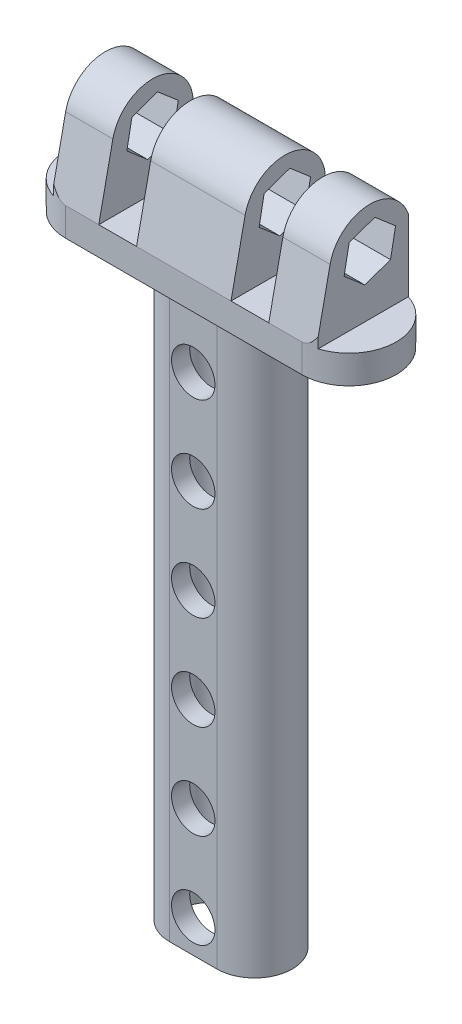
from build123d import *

# Parameters (mm, degrees)
EXTRUDE_1_DEPTH     = 3
EXTRUDE_2_DEPTH     = 14
EXTRUDE_3_DEPTH     = 60
SKETCH_4_R          = 2.3
CUT_EXTRUDE_1_DEPTH = 60
SKETCH_6_W          = 4
SKETCH_6_H          = 10.529479437
CUT_EXTRUDE_2_DEPTH = 60
CUT_EXTRUDE_4_DEPTH = 60


with BuildPart() as part:
    # 草图1 → 凸台-拉伸1 (new body)
    with BuildSketch(Plane(origin=(0, 0, 0), x_dir=(1, 0, 0), z_dir=(0, 1, 0))):
        with BuildLine():
            Line((-12.5, 5), (12.5, 5))
            ThreePointArc((12.5, 5), (17.5, 0), (12.5, -5))
            Line((12.5, -5), (-12.5, -5))
            ThreePointArc((-12.5, -5), (-17.5, 0), (-12.5, 5))
        make_face()
    extrude(amount=EXTRUDE_1_DEPTH)

    # 草图2 → 凸台-拉伸2 (add, symmetric)
    with BuildSketch(Plane(origin=(0, 0, 0), x_dir=(0, 0, -1), z_dir=(1, 0, 0))):
        with BuildLine():
            Line((-5, 3), (-3.508412685, 10.112107418))
            ThreePointArc((-3.508412685, 10.112107418), (1.143689593, 13.506528918), (5, 9.229494551))
            Line((5, 9.229494551), (5, 3))
            Line((5, 3), (-5, 3))
        make_face()
        Polygon((2.88904253, 7.347609244), (3.424289305, 10.184305249), (1.235261889, 12.066190555), (-1.489012301, 11.111379858), (-2.024259076, 8.274683853), (0.164768339, 6.392798546), align=None, mode=Mode.SUBTRACT)
    extrude(amount=EXTRUDE_2_DEPTH, both=True)

    # 草图3 → 凸台-拉伸3 (add)
    with BuildSketch(Plane.XZ):
        with BuildLine():
            Line((-2.5, 4), (2.5, 4))
            ThreePointArc((2.5, 4), (6.5, 0), (2.5, -4))
            Line((2.5, -4), (-2.5, -4))
            ThreePointArc((-2.5, -4), (-6.5, 0), (-2.5, 4))
        make_face()
        with BuildLine():
            Line((-2.705614888, 2.07197125), (2.705614888, 2.07197125))
            ThreePointArc((2.705614888, 2.07197125), (4.777586138, 0), (2.705614888, -2.07197125))
            Line((2.705614888, -2.07197125), (-2.705614888, -2.07197125))
            ThreePointArc((-2.705614888, -2.07197125), (-4.777586138, 0), (-2.705614888, 2.07197125))
        make_face(mode=Mode.SUBTRACT)
    extrude(amount=EXTRUDE_3_DEPTH)

    # 草图4 → 切除-拉伸1 (cut)
    with BuildSketch(Plane.XY.offset(4)):
        with Locations((0, -6.528023855)):
            Circle(SKETCH_4_R)
        with Locations((0, -16.528023855)):
            Circle(SKETCH_4_R)
        with Locations((0, -26.528023855)):
            Circle(SKETCH_4_R)
        with Locations((0, -36.528023855)):
            Circle(SKETCH_4_R)
        with Locations((0, -46.528023855)):
            Circle(SKETCH_4_R)
        with Locations((0, -56.528023855)):
            Circle(SKETCH_4_R)
    extrude(amount=-CUT_EXTRUDE_1_DEPTH, mode=Mode.SUBTRACT)

    # 草图6 → 切除-拉伸2 (cut)
    with BuildSketch(Plane(origin=(0, 0, -5), x_dir=(-1, 0, 0), z_dir=(0, 0, -1))):
        with Locations((-7, 8.264739718)):
            Rectangle(SKETCH_6_W, SKETCH_6_H)
        with Locations((7, 8.264739718)):
            Rectangle(SKETCH_6_W, SKETCH_6_H)
    extrude(amount=-CUT_EXTRUDE_2_DEPTH, mode=Mode.SUBTRACT)

    # 草图7 → 切除-拉伸4 (cut)
    with BuildSketch(Plane.XZ):
        with BuildLine():
            Line((-21.020097189, 8.097906294), (21.020097189, 8.097906294))
            ThreePointArc((21.020097189, 8.097906294), (29.118003483, 0), (21.020097189, -8.097906294))
            Line((21.020097189, -8.097906294), (-21.020097189, -8.097906294))
            ThreePointArc((-21.020097189, -8.097906294), (-29.118003483, 0), (-21.020097189, 8.097906294))
        make_face()
        with BuildLine():
            Line((-12.5, -5), (12.5, -5))
            ThreePointArc((12.5, -5), (17.5, 0), (12.5, 5))
            Line((12.5, 5), (-12.5, 5))
            ThreePointArc((-12.5, 5), (-17.5, 0), (-12.5, -5))
        make_face(mode=Mode.SUBTRACT)
    extrude(amount=-CUT_EXTRUDE_4_DEPTH, mode=Mode.SUBTRACT)


solid = part.part
